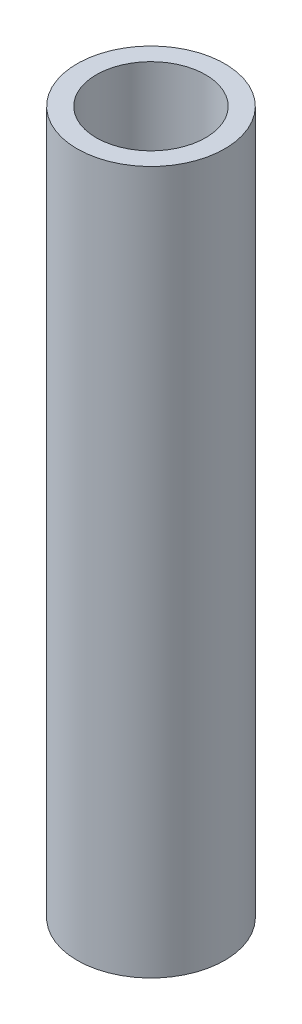
from build123d import *

# Parameters (mm, degrees)
SKETCH1_R           = 10.668
SKETCH1_R_2         = 7.8994
BOSS_EXTRUDE1_DEPTH = 101.6


with BuildPart() as part:
    # Sketch1 → Boss-Extrude1 (new body)
    with BuildSketch(Plane(origin=(0, 0, 0), x_dir=(1, 0, 0), z_dir=(0, 1, 0))):
        with Locations(Location((0, 0, 0), (0, 0, 270))):
            Circle(SKETCH1_R)
        with Locations(Location((0, 0, 0), (0, 0, 270))):
            Circle(SKETCH1_R_2, mode=Mode.SUBTRACT)
    extrude(amount=BOSS_EXTRUDE1_DEPTH)


solid = part.part
